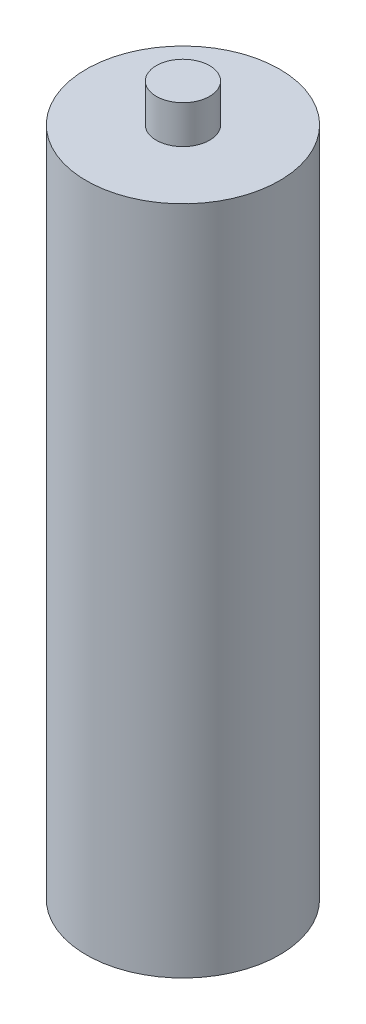
from build123d import *

# Parameters (mm, degrees)
SKETCH_1_R      = 50.8
EXTRUDE_1_DEPTH = 352.425
SKETCH_2_R      = 14
EXTRUDE_2_DEPTH = 20


with BuildPart() as part:
    # 草图1 → 凸台-拉伸1 (new body)
    with BuildSketch(Plane(origin=(0, 0, 0), x_dir=(1, 0, 0), z_dir=(0, 1, 0))):
        with Locations(Location((0, 0, 0), (0, 0, 90))):
            Circle(SKETCH_1_R)
    extrude(amount=EXTRUDE_1_DEPTH)

    # 草图2 → 凸台-拉伸2 (add)
    with BuildSketch(Plane(origin=(0, 352.425, 0), x_dir=(1, 0, 0), z_dir=(0, 1, 0))):
        with Locations(Location((0, 0, 0), (0, 0, 270))):
            Circle(SKETCH_2_R)
    extrude(amount=EXTRUDE_2_DEPTH)


solid = part.part
